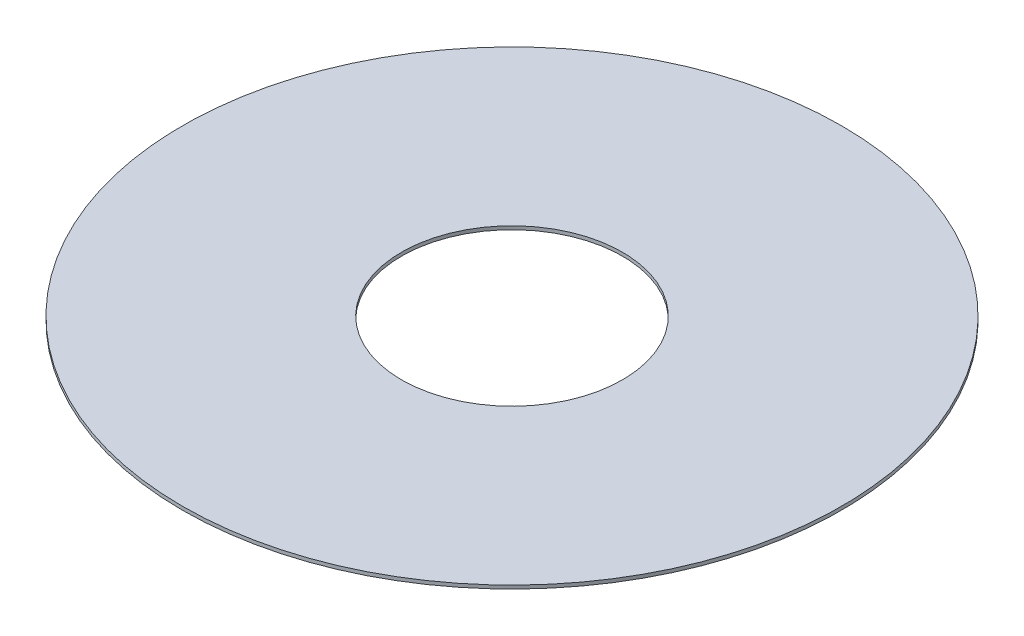
from build123d import *

# Parameters (mm, degrees)
SKETCH1_R           = 47.7
SKETCH1_R_2         = 16
BOSS_EXTRUDE1_DEPTH = 0.5


with BuildPart() as part:
    # Sketch1 → Boss-Extrude1 (new body)
    with BuildSketch(Plane(origin=(0, 0, 0), x_dir=(1, 0, 0), z_dir=(0, 1, 0))):
        with Locations(Location((0, 0, 0), (0, 0, 270))):
            Circle(SKETCH1_R)
        with Locations(Location((0, 0, 0), (0, 0, 270))):
            Circle(SKETCH1_R_2, mode=Mode.SUBTRACT)
    extrude(amount=BOSS_EXTRUDE1_DEPTH)


solid = part.part
